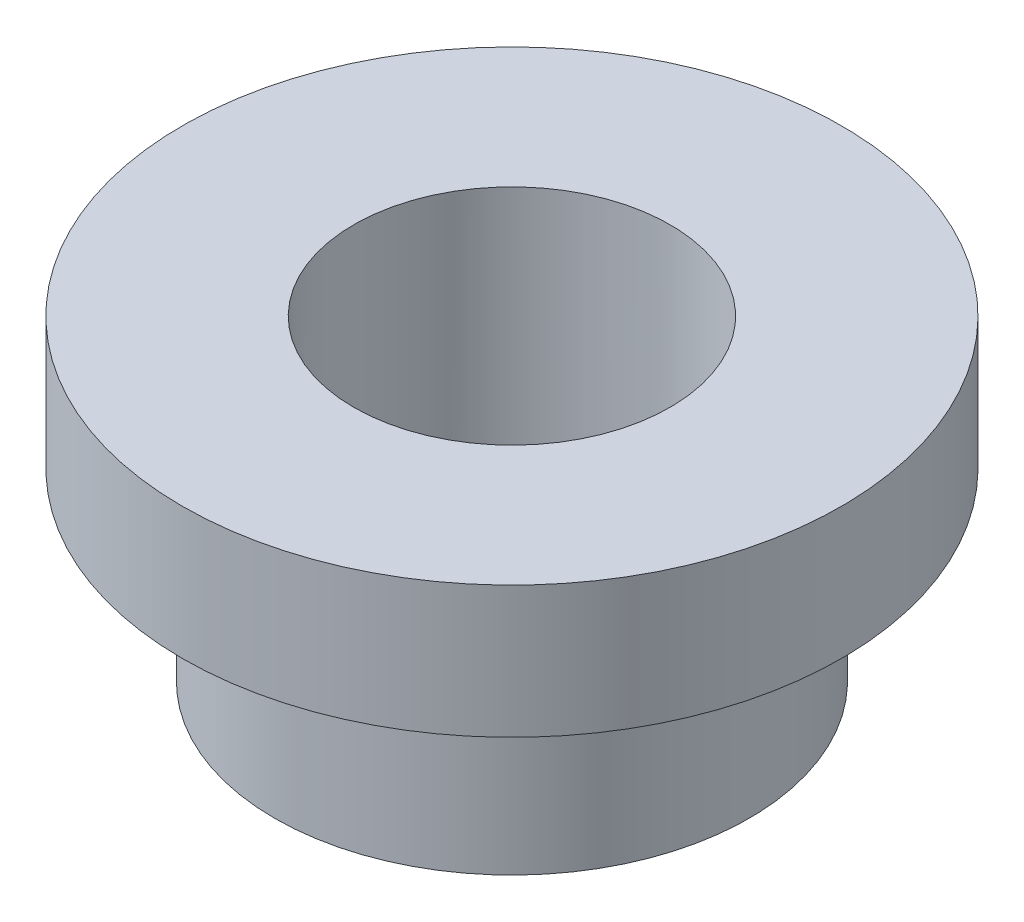
from build123d import *

# Parameters (mm, degrees)
SKETCH1_R           = 1.25
SKETCH1_R_2         = 0.6
BOSS_EXTRUDE1_DEPTH = 0.5
SKETCH2_R           = 0.9
SKETCH2_R_2         = 0.6
BOSS_EXTRUDE2_DEPTH = 0.7


with BuildPart() as part:
    # Sketch1 → Boss-Extrude1 (new body)
    with BuildSketch(Plane(origin=(0, 0, 0), x_dir=(1, 0, 0), z_dir=(0, 1, 0))):
        with Locations(Location((0, 0, 0), (0, 0, 270))):
            Circle(SKETCH1_R)
        with Locations(Location((0, 0, 0), (0, 0, 270))):
            Circle(SKETCH1_R_2, mode=Mode.SUBTRACT)
    extrude(amount=-BOSS_EXTRUDE1_DEPTH)

    # Sketch2 → Boss-Extrude2 (add)
    with BuildSketch(Plane.XZ.offset(0.5)):
        with Locations(Location((0, 0, 0), (0, 0, 90))):
            Circle(SKETCH2_R)
        with Locations(Location((0, 0, 0), (0, 0, 90))):
            Circle(SKETCH2_R_2, mode=Mode.SUBTRACT)
    extrude(amount=BOSS_EXTRUDE2_DEPTH)


solid = part.part
